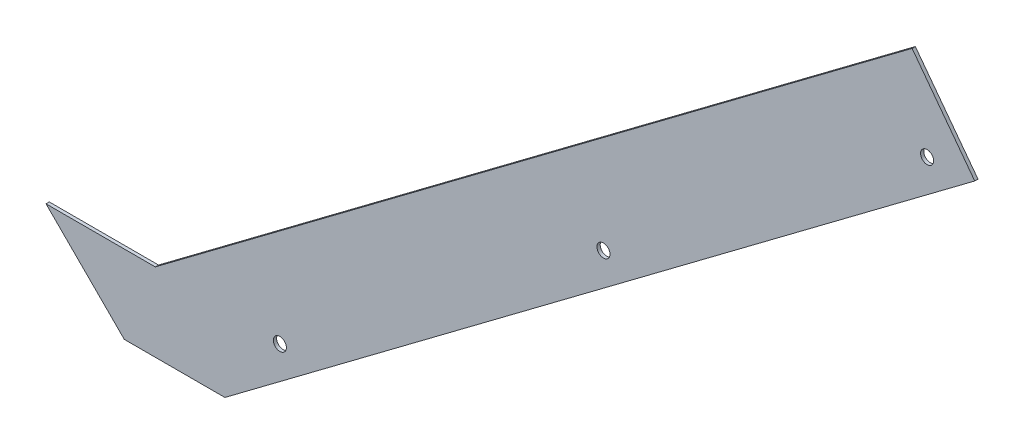
from build123d import *

# Parameters (mm, degrees)
BOSS_EXTRUDE1_DEPTH         = 1.5875
F_1_4_0_25_DIAMETER_HOLE1_D = 6.35


with BuildPart() as part:
    # Sketch1 → Boss-Extrude1 (new body)
    with BuildSketch(Plane.XY):
        Polygon((0, 0), (53.18125, 0), (421.48125, 276.225), (451.96125, 235.585), (87.047916667, -38.1), (38.1, -38.1), align=None)
    extrude(amount=BOSS_EXTRUDE1_DEPTH)

    # 1/4 (0.25) Diameter Hole1 (through all)
    with Locations(Plane.XY.offset(1.5875)):
        with Locations((428.77096872, 234.06728904), (271.29096872, 115.95728904), (113.81096872, -2.15271096)):
            Hole(F_1_4_0_25_DIAMETER_HOLE1_D / 2)


solid = part.part
